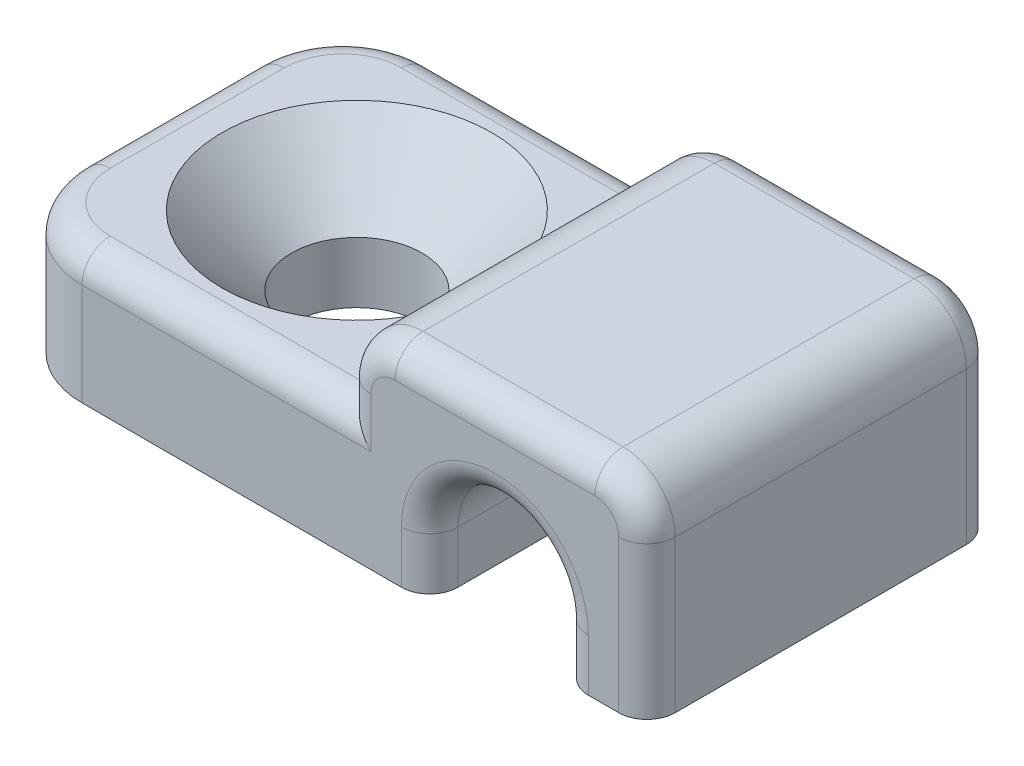
from build123d import *

# Parameters (mm, degrees)
RESSALTO_EXTRUS_O1_DEPTH = 8
ESBO_O2_R                = 1.5
CORTE_EXTRUS_O1_DEPTH    = 6
CHANFRO2_SIZE            = 1.6
FILETE3_R                = 2
FILETE5_R                = 1.2
FILETE6_R                = 0.65


with BuildPart() as part:
    # Esboço1 → Ressalto-extrusão1 (new body)
    with BuildSketch(Plane.XY):
        with BuildLine():
            Line((-11.5, -1.2), (-11.5, 1.8))
            Line((-11.5, 1.8), (-3.5, 1.8))
            Line((-3.5, 1.8), (-3.5, 3.5))
            Line((-3.5, 3.5), (3.5, 3.5))
            Line((3.5, 3.5), (3.5, -1.2))
            Line((3.5, -1.2), (1.5, -1.2))
            Line((1.5, -1.2), (1.5, 0))
            ThreePointArc((1.5, 0), (0, 1.5), (-1.5, 0))
            Line((-1.5, 0), (-1.5, -1.2))
            Line((-1.5, -1.2), (-11.5, -1.2))
        make_face()
    extrude(amount=RESSALTO_EXTRUS_O1_DEPTH)

    # Esboço2 → Corte-extrusão1 (cut)
    with BuildSketch(Plane(origin=(0, 1.8, 0), x_dir=(1, 0, 0), z_dir=(0, 1, 0))):
        with Locations(Location((-7.175, -4, 0), (0, 0, 180))):
            Circle(ESBO_O2_R)
    extrude(amount=-CORTE_EXTRUS_O1_DEPTH, mode=Mode.SUBTRACT)

    # Chanfro2
    chanfro2_edges = [part.edges().sort_by_distance(p)[0] for p in [
        (-5.675, 1.8, 4),
    ]]
    chamfer(chanfro2_edges, length=CHANFRO2_SIZE)

    # Filete3
    filete3_edges = [part.edges().sort_by_distance(p)[0] for p in [
        (-11.5, 0.3, 0),
        (-11.5, 0.3, 8),
    ]]
    fillet(filete3_edges, radius=FILETE3_R)

    # Filete5
    filete5_edges = [part.edges().sort_by_distance(p)[0] for p in [
        (-3.5, 3.5, 4),
        (3.5, 3.5, 4),
    ]]
    fillet(filete5_edges, radius=FILETE5_R)

    # Filete6
    filete6_edges = [part.edges().sort_by_distance(p)[0] for p in [
        (-1.5, -0.6, 0),
        (-6.5, 1.8, 0),
        (3.5, 0.55, 0),
        (1.5, -0.6, 0),
        (0, 1.5, 0),
        (3.5, 0.55, 8),
        (-6.5, 1.8, 8),
        (-1.5, -0.6, 8),
        (-11.5, 1.8, 4),
        (-10.914213562, 1.8, 0.585786438),
        (-10.914213562, 1.8, 7.414213562),
        (0, 1.5, 8),
        (-3.5, 2.05, 0),
        (-3.5, 2.05, 8),
        (0, 3.5, 0),
        (3.148528137, 3.148528137, 0),
        (-3.148528137, 3.148528137, 0),
        (0, 3.5, 8),
        (3.148528137, 3.148528137, 8),
        (-3.148528137, 3.148528137, 8),
        (1.5, -0.6, 8),
    ]]
    fillet(filete6_edges, radius=FILETE6_R)


solid = part.part
